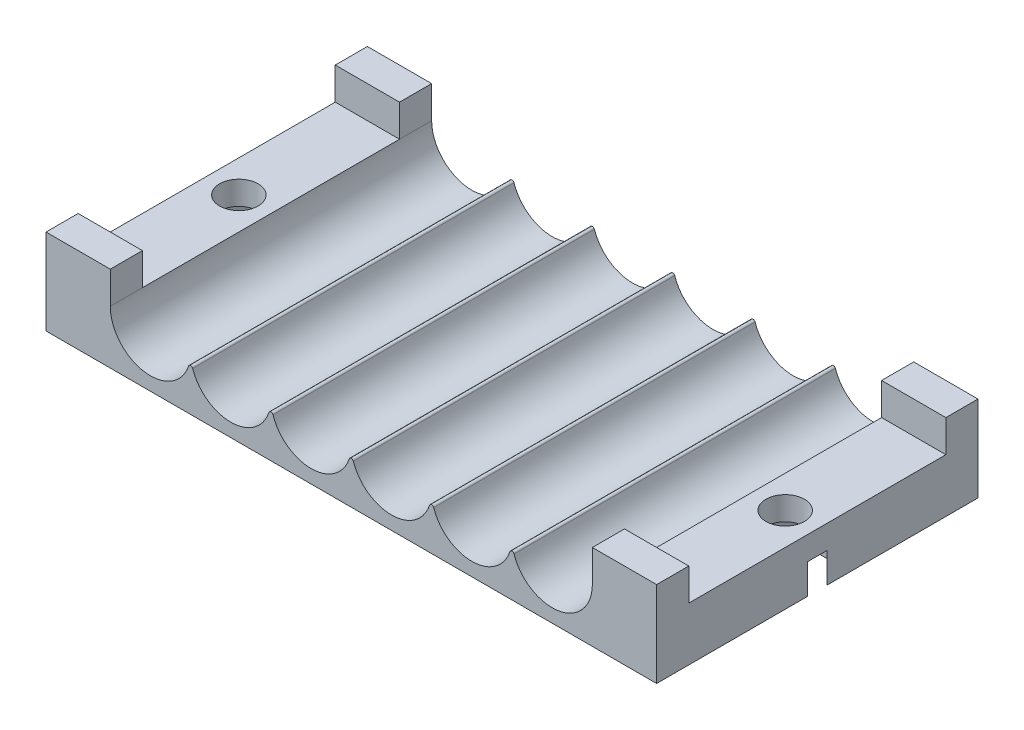
from build123d import *

# Parameters (mm, degrees)
RESSALTO_EXTRUS_O1_DEPTH = 15
ESBO_O2_R                = 1.8
CORTE_EXTRUS_O1_DEPTH    = 33.592176975
FILETE1_R                = 0.2
ESBO_O3_W                = 6
ESBO_O3_H                = 3
RESSALTO_EXTRUS_O2_DEPTH = 3
CORTE_EXTRUS_O2_DEPTH    = 2.8


with BuildPart() as part:
    # Esboço1 → Ressalto-extrusão1 (new, symmetric)
    with BuildSketch(Plane.XY):
        with BuildLine():
            Line((-22.5, 0), (22.5, 0))
            Line((22.5, 0), (28.5, 0))
            Line((28.5, 0), (28.5, 5))
            Line((28.5, 5), (22.5, 5))
            ThreePointArc((22.5, 5), (18.75, 1.25), (15, 5))
            ThreePointArc((15, 5), (11.25, 1.25), (7.5, 5))
            ThreePointArc((7.5, 5), (3.75, 1.25), (0, 5))
            ThreePointArc((0, 5), (-3.75, 1.25), (-7.5, 5))
            ThreePointArc((-7.5, 5), (-11.25, 1.25), (-15, 5))
            ThreePointArc((-15, 5), (-18.75, 1.25), (-22.5, 5))
            Line((-22.5, 5), (-28.5, 5))
            Line((-28.5, 5), (-28.5, 0))
            Line((-28.5, 0), (-22.5, 0))
        make_face()
    extrude(amount=RESSALTO_EXTRUS_O1_DEPTH, both=True)

    # Esboço2 → Corte-extrusão1 (cut, through all)
    with BuildSketch(Plane(origin=(0, 5, 0), x_dir=(1, 0, 0), z_dir=(0, 1, 0))):
        with Locations(Location((-25.5, 0, 0), (0, 0, 180))):
            Circle(ESBO_O2_R)
        with Locations((25.5, 0)):
            Circle(ESBO_O2_R)
    extrude(amount=-CORTE_EXTRUS_O1_DEPTH, mode=Mode.SUBTRACT)

    # Filete1
    filete1_edges = [part.edges().sort_by_distance(p)[0] for p in [
        (-15, 5, 0),
        (-7.5, 5, 0),
        (0, 5, 0),
        (7.5, 5, 0),
        (15, 5, 0),
    ]]
    fillet(filete1_edges, radius=FILETE1_R)

    # Esboço3 → Ressalto-extrusão2 (add)
    with BuildSketch(Plane(origin=(0, 5, 0), x_dir=(1, 0, 0), z_dir=(0, 1, 0))):
        with Locations((-25.5, 13.5)):
            Rectangle(ESBO_O3_W, ESBO_O3_H)
        with Locations((-25.5, -13.5)):
            Rectangle(ESBO_O3_W, ESBO_O3_H)
        with Locations((25.5, -13.5)):
            Rectangle(ESBO_O3_W, ESBO_O3_H)
        with Locations((25.5, 13.5)):
            Rectangle(ESBO_O3_W, ESBO_O3_H)
    extrude(amount=RESSALTO_EXTRUS_O2_DEPTH)

    # Esboço4 → Corte-extrusão2 (cut)
    with BuildSketch(Plane.XZ):
        Polygon((-29.021836642, 0), (-27.260918321, -3.05), (-23.739081679, -3.05), (-21.978163358, 0), (-23.739081679, 3.05), (-27.260918321, 3.05), align=None)
        Polygon((27.260918321, 3.05), (29.021836642, 0), (27.260918321, -3.05), (23.739081679, -3.05), (21.978163358, 0), (23.739081679, 3.05), align=None)
    extrude(amount=-CORTE_EXTRUS_O2_DEPTH, mode=Mode.SUBTRACT)


solid = part.part
